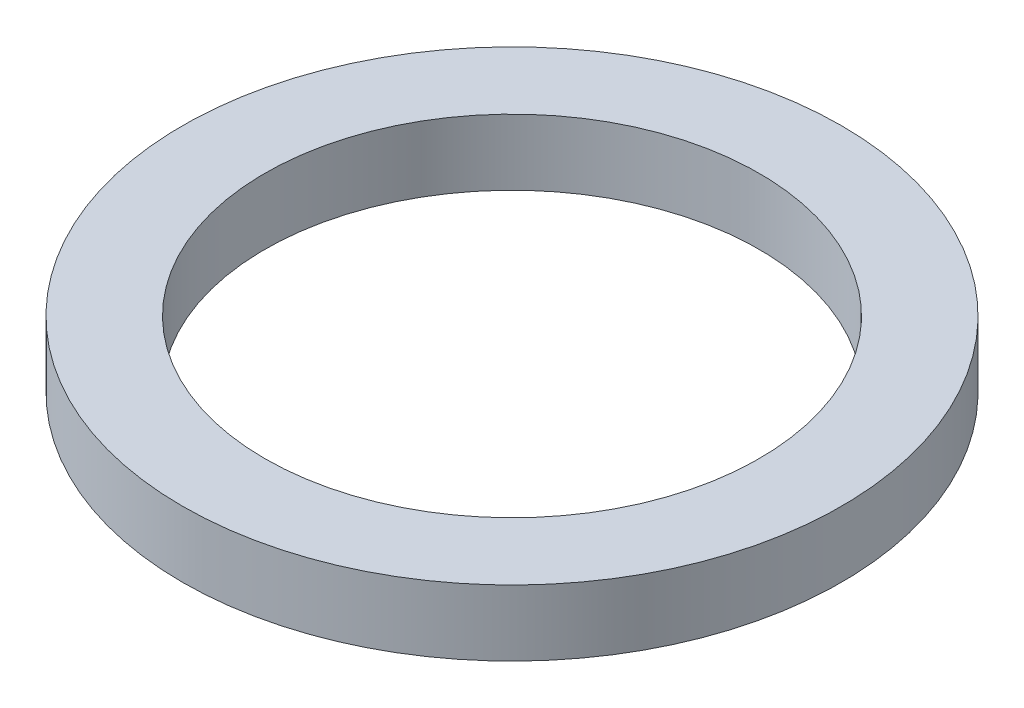
from build123d import *

# Parameters (mm, degrees)
SKETCH1_R           = 10
BOSS_EXTRUDE1_DEPTH = 2
CUT_EXTRUDE1_REACH  = 16.283
SKETCH2_R           = 7.5


with BuildPart() as part:
    # Sketch1 → Boss-Extrude1 (new body)
    with BuildSketch(Plane(origin=(0, 0, 0), x_dir=(1, 0, 0), z_dir=(0, 1, 0))):
        with Locations(Location((0, 0, 0), (0, 0, 270))):
            Circle(SKETCH1_R)
    extrude(amount=BOSS_EXTRUDE1_DEPTH)

    # Sketch2 → Cut-Extrude1 (cut, up to next)
    with BuildSketch(Plane(origin=(0, 2, 0), x_dir=(1, 0, 0), z_dir=(0, 1, 0)), mode=Mode.PRIVATE) as cut_extrude1_sk1:
        with Locations(Location((0, 0, 0), (0, 0, 270))):
            Circle(SKETCH2_R)
    cut_extrude1_tool1 = extrude(cut_extrude1_sk1.sketch, amount=-CUT_EXTRUDE1_REACH, mode=Mode.PRIVATE) & part.part
    add(cut_extrude1_tool1.solids().sort_by_distance((0, 2, 0))[0], mode=Mode.SUBTRACT)


solid = part.part
